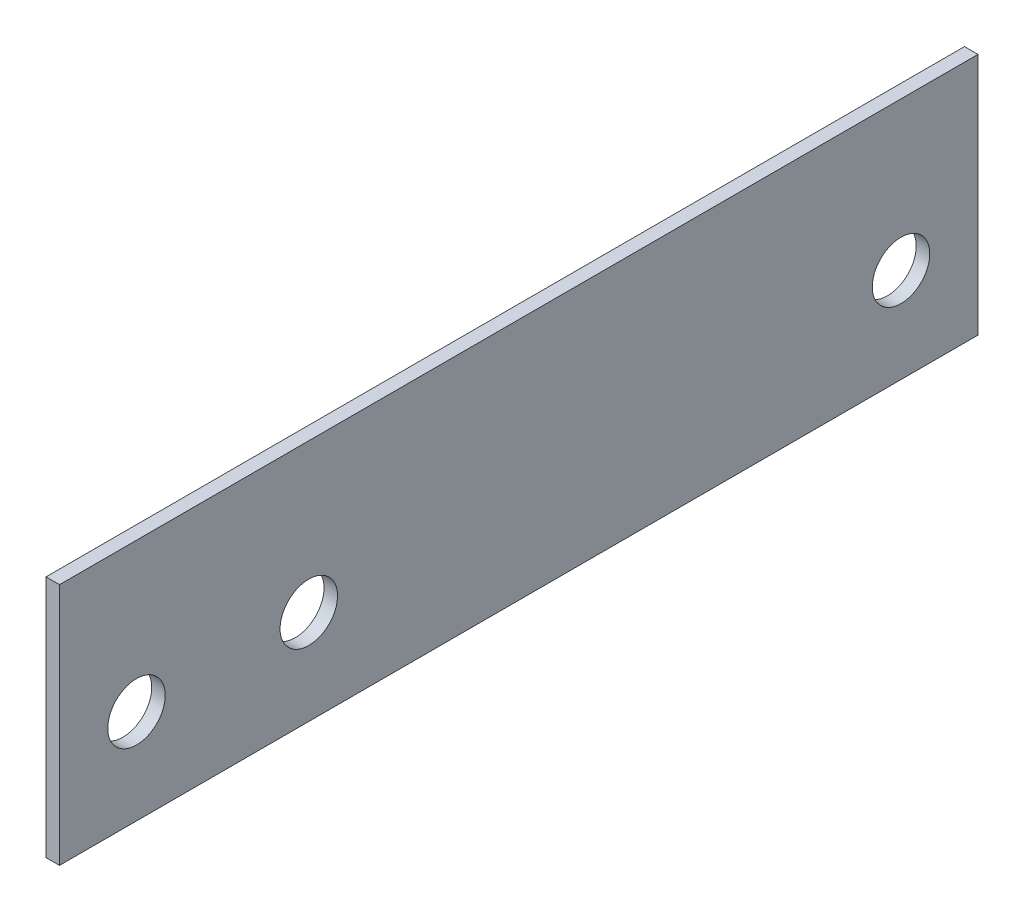
from build123d import *

# Parameters (mm, degrees)
SKETCH1_W               = 107.95
SKETCH1_H               = 28.575
BOSS_EXTRUDE1_DEPTH     = 1.5875
F_1_4_CLEARANCE_HOLE1_D = 6.7564


with BuildPart() as part:
    # Sketch1 → Boss-Extrude1 (new body)
    with BuildSketch(Plane(origin=(0, 0, 0), x_dir=(0, 0, -1), z_dir=(1, 0, 0))):
        Rectangle(SKETCH1_W, SKETCH1_H)
    extrude(amount=BOSS_EXTRUDE1_DEPTH)

    # 1/4 Clearance Hole1 (through all)
    with Locations(Plane(origin=(-6.35, -14.6685, 57.15), x_dir=(0, 1, 0), z_dir=(-1, 0, 0))):
        with Locations((11.4935, 32.474915951), (11.4935, 12.224438398), (11.4935, 102.075561602)):
            Hole(F_1_4_CLEARANCE_HOLE1_D / 2)


solid = part.part
